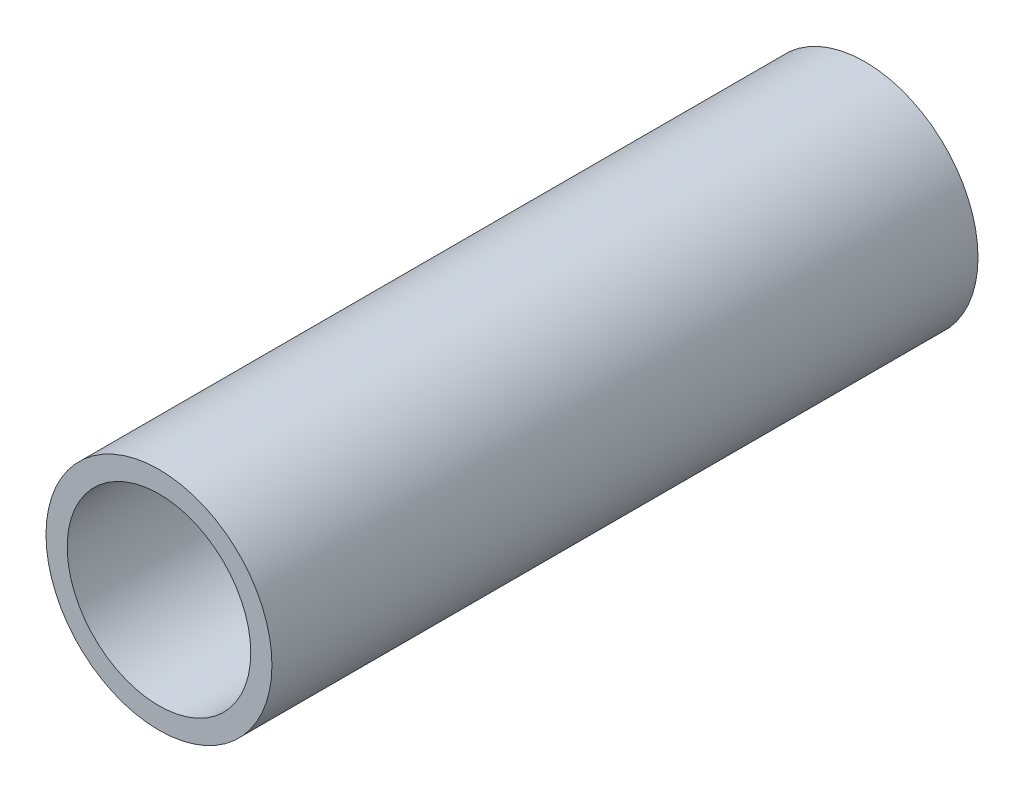
from build123d import *

# Parameters (mm, degrees)
ESQUISSE1_R        = 8
ESQUISSE1_R_2      = 6.5
BOSS_EXTRU_1_DEPTH = 50


with BuildPart() as part:
    # Esquisse1 → Boss.-Extru.1 (new body)
    with BuildSketch(Plane.XY):
        Circle(ESQUISSE1_R)
        Circle(ESQUISSE1_R_2, mode=Mode.SUBTRACT)
    extrude(amount=BOSS_EXTRU_1_DEPTH)


solid = part.part
